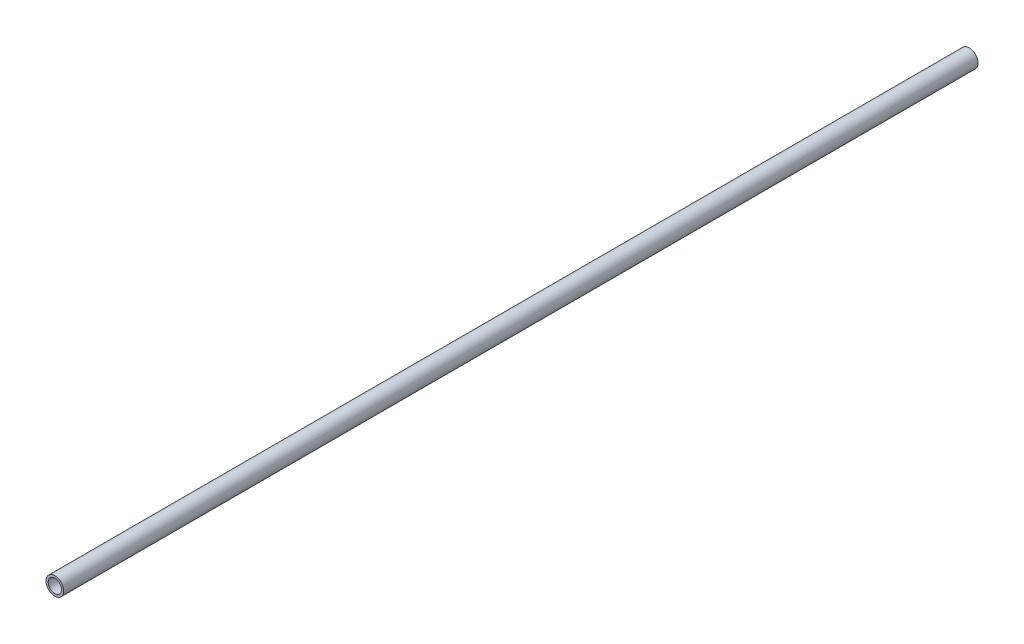
from build123d import *

# Parameters (mm, degrees)
SKETCH1_R           = 2
SKETCH1_R_2         = 1.5
BOSS_EXTRUDE1_DEPTH = 206.375


with BuildPart() as part:
    # Sketch1 → Boss-Extrude1 (new body)
    with BuildSketch(Plane.XY):
        Circle(SKETCH1_R)
        Circle(SKETCH1_R_2, mode=Mode.SUBTRACT)
    extrude(amount=BOSS_EXTRUDE1_DEPTH)


solid = part.part
